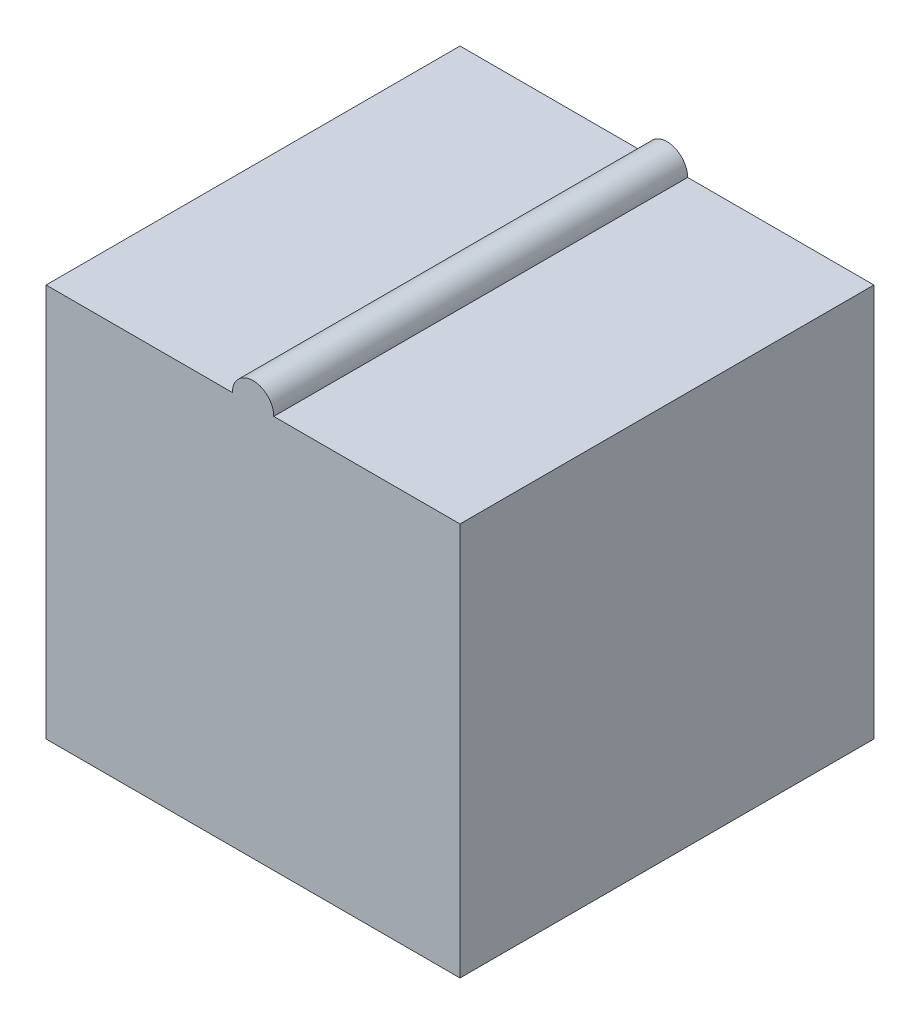
from build123d import *

# Parameters (mm, degrees)
BOSS_EXTRUDE1_DEPTH = 20


with BuildPart() as part:
    # Sketch1 → Boss-Extrude1 (new body)
    with BuildSketch(Plane.XY):
        with BuildLine():
            Line((11, 19), (20, 19))
            Line((20, 19), (20, 0))
            Line((20, 0), (0, 0))
            Line((0, 0), (0, 19))
            Line((0, 19), (9, 19))
            ThreePointArc((9, 19), (10, 20), (11, 19))
        make_face()
    extrude(amount=BOSS_EXTRUDE1_DEPTH)


solid = part.part
